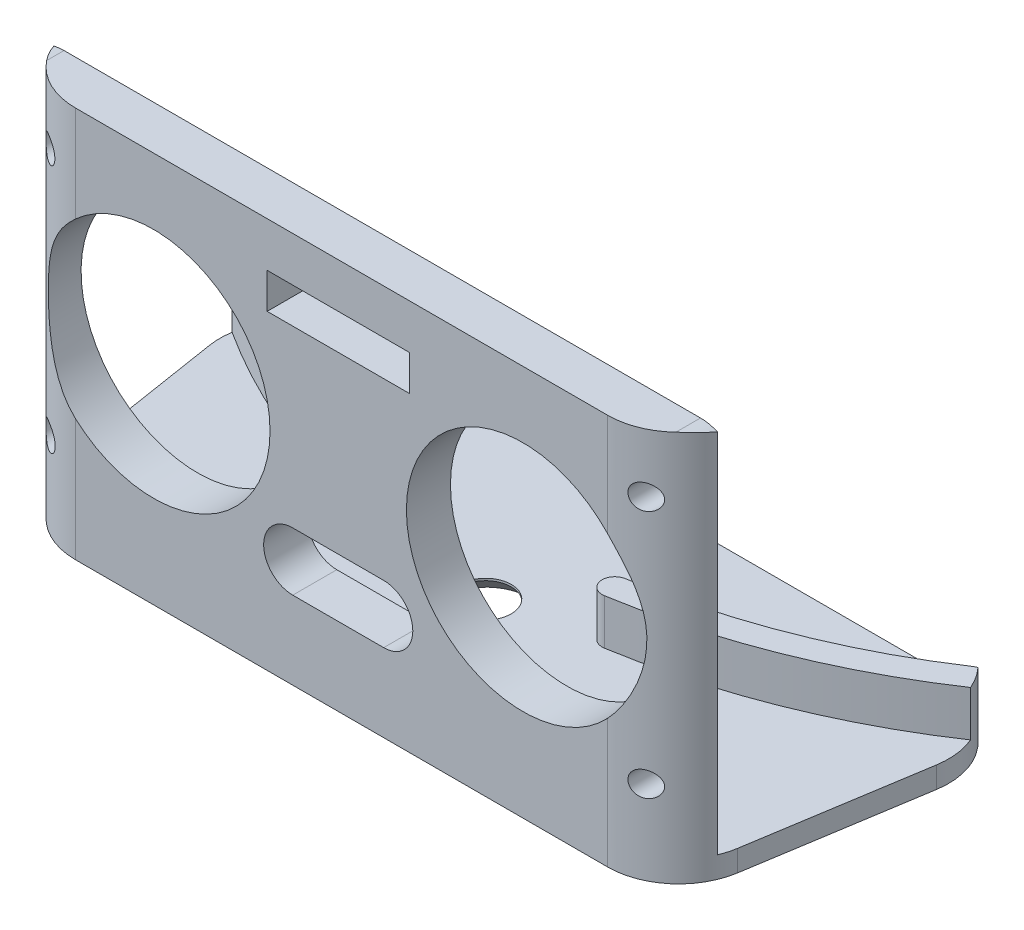
from build123d import *

# Parameters (mm, degrees)
BOSS_EXTRU_1_DEPTH                                = 1.5
BOSS_EXTRU_2_START                                = 0.3
ESQUISSE2_R                                       = 0.83
ESQUISSE2_R_2                                     = 0.87
ESQUISSE2_R_3                                     = 8.2
BOSS_EXTRU_2_DEPTH                                = 3.2
ENL_V_MAT_EXTRU_1_DEPTH                           = 937.37300154
ENL_V_MAT_EXTRU_1_DEPTH_BACK                      = 937.37300154
ESQUISSE1_2_OUTSIDE_W                             = 65.507
ESQUISSE1_2_OUTSIDE_H                             = 36.406
BOSS_EXTRU_3_START                                = 3.2
BOSS_EXTRU_3_DEPTH                                = 3.2
FRAISAGE_POUR_VIS_T_TE_FRAIS_E_BOMB_E_D           = 3.6
FRAISAGE_POUR_VIS_T_TE_FRAIS_E_BOMB_E_CSINK_D     = 6.3
FRAISAGE_POUR_VIS_T_TE_FRAIS_E_BOMB_E_CSINK_ANGLE = 90
ENL_V_MAT_EXTRU_2_DEPTH                           = 118.914346143
ENL_V_MAT_EXTRU_2_DEPTH_BACK                      = 118.914346143
ESQUISSE8_W                                       = 10.000000119
ESQUISSE8_H                                       = 2.5
ESQUISSE9_W                                       = 46.70954475
ESQUISSE9_H                                       = 0.31
ENL_V_MAT_EXTRU_3_DEPTH                           = 10
BOSS_EXTRU_4_DEPTH                                = 3.39
ENL_V_MAT_EXTRU_4_DEPTH                           = 10


with BuildPart() as part:
    # Esquisse1 → Boss.-Extru.1 (new body)
    with BuildSketch(Plane.XZ.offset(51.373319983)):
        with BuildLine():
            Line((-98.670544596, -930.328379496), (-57.379707563, -930.328379496))
            ThreePointArc((-57.379707563, -930.328379496), (-53.577586343, -928.575512729), (-52.441309896, -924.545929189))
            Line((-52.441309896, -924.545929189), (-54.35688847, -912.455846702))
            ThreePointArc((-54.35688847, -912.455846702), (-56.048152904, -909.43617579), (-59.295286137, -908.238297009))
            Line((-59.295286137, -908.238297009), (-96.754966023, -908.238297009))
            ThreePointArc((-96.754966023, -908.238297009), (-100.002099255, -909.43617579), (-101.69336369, -912.455846702))
            Line((-101.69336369, -912.455846702), (-103.608942263, -924.545929189))
            ThreePointArc((-103.608942263, -924.545929189), (-102.472665816, -928.575512729), (-98.670544596, -930.328379496))
        make_face()
    extrude(amount=BOSS_EXTRU_1_DEPTH)

    # Esquisse2 → Boss.-Extru.2 (add)
    with BuildSketch(Plane.XY.offset(-911.638297009).offset(BOSS_EXTRU_2_START)):
        with BuildLine():
            Line((-52.906931145, -51.073319983), (-52.906931145, -31.173319983))
            ThreePointArc((-52.906931145, -31.173319983), (-53.77096614, -29.087354978), (-55.856931145, -28.223319983))
            Line((-55.856931145, -28.223319983), (-100.656931145, -28.223319983))
            ThreePointArc((-100.656931145, -28.223319983), (-102.742896149, -29.087354978), (-103.606931145, -31.173319983))
            Line((-103.606931145, -31.173319983), (-103.606931145, -51.073319983))
            Line((-103.606931145, -51.073319983), (-103.608942263, -51.373319983))
            Line((-103.608942263, -51.373319983), (-52.906931145, -51.373319983))
            Line((-52.906931145, -51.373319983), (-52.906931145, -51.073319983))
        make_face()
        with Locations((-99.356931145, -32.373319983)):
            Circle(ESQUISSE2_R, mode=Mode.SUBTRACT)
        with Locations((-99.356931145, -49.873319983)):
            Circle(ESQUISSE2_R_2, mode=Mode.SUBTRACT)
        with Locations((-57.156931145, -49.873319983)):
            Circle(ESQUISSE2_R_2, mode=Mode.SUBTRACT)
        with Locations((-57.156931145, -32.373319983)):
            Circle(ESQUISSE2_R_2, mode=Mode.SUBTRACT)
        with Locations((-91.256931145, -41.073319983)):
            Circle(ESQUISSE2_R_3, mode=Mode.SUBTRACT)
        with Locations((-65.256931145, -41.073319983)):
            Circle(ESQUISSE2_R_3, mode=Mode.SUBTRACT)
    extrude(amount=BOSS_EXTRU_2_DEPTH)

    # Esquisse1<2> outside → Enlèv. mat.-Extru.1 (cut, two sides: drawn at the far end of the back side and taken through both)
    with BuildSketch(Plane.XZ.offset(51.373319983).offset(-ENL_V_MAT_EXTRU_1_DEPTH_BACK)):
        with Locations((-78.0255, -919.233)):
            Rectangle(ESQUISSE1_2_OUTSIDE_W, ESQUISSE1_2_OUTSIDE_H)
        with BuildLine():
            Line((-98.670544596, -930.328379496), (-57.379707563, -930.328379496))
            ThreePointArc((-57.379707563, -930.328379496), (-53.577586343, -928.575512729), (-52.441309896, -924.545929189))
            Line((-52.441309896, -924.545929189), (-54.35688847, -912.455846702))
            ThreePointArc((-54.35688847, -912.455846702), (-56.048152904, -909.43617579), (-59.295286137, -908.238297009))
            Line((-59.295286137, -908.238297009), (-96.754966023, -908.238297009))
            ThreePointArc((-96.754966023, -908.238297009), (-100.002099255, -909.43617579), (-101.69336369, -912.455846702))
            Line((-101.69336369, -912.455846702), (-103.608942263, -924.545929189))
            ThreePointArc((-103.608942263, -924.545929189), (-102.472665816, -928.575512729), (-98.670544596, -930.328379496))
        make_face(mode=Mode.SUBTRACT)
    extrude(amount=ENL_V_MAT_EXTRU_1_DEPTH + ENL_V_MAT_EXTRU_1_DEPTH_BACK, mode=Mode.SUBTRACT)

    # Esquisse3 → Boss.-Extru.3 (add)
    with BuildSketch(Plane(origin=(0, -51.373319983, 0), x_dir=(1, 0, 0), z_dir=(0, 1, 0)).offset(BOSS_EXTRU_3_START)):
        with BuildLine():
            ThreePointArc((-102.982508149, 927.859578881), (-103.376352569, 927.018163899), (-103.607735067, 926.118411302))
            ThreePointArc((-103.607735067, 926.118411302), (-94.922727103, 921.708622836), (-85.517242835, 919.176338626))
            ThreePointArc((-85.517242835, 919.176338626), (-84.485661398, 919.92188523), (-85.231208003, 920.953466667))
            ThreePointArc((-85.231208003, 920.953466667), (-94.473289986, 923.464655248), (-102.982508149, 927.859578881))
        make_face()
        with BuildLine():
            ThreePointArc((-71.253122945, 919.966173311), (-61.614344657, 922.608295593), (-52.765422079, 927.254092215))
            ThreePointArc((-52.765422079, 927.254092215), (-53.176239028, 928.035934163), (-53.718212164, 928.733295272))
            ThreePointArc((-53.718212164, 928.733295272), (-53.866494414, 928.670740496), (-54.005911098, 928.59034327))
            ThreePointArc((-54.005911098, 928.59034327), (-62.407028515, 924.230869883), (-71.539157777, 921.743301352))
            ThreePointArc((-71.539157777, 921.743301352), (-72.284704381, 920.711719915), (-71.253122945, 919.966173311))
        make_face()
    extrude(amount=-BOSS_EXTRU_3_DEPTH)

    # Fraisage pour vis à tête fraisée bombée M31 (through all)
    with Locations(Plane.XZ.offset(52.873319983)):
        with Locations((-78.416666646, -918.775310047)):
            CounterSinkHole(FRAISAGE_POUR_VIS_T_TE_FRAIS_E_BOMB_E_D / 2, FRAISAGE_POUR_VIS_T_TE_FRAIS_E_BOMB_E_CSINK_D / 2, counter_sink_angle=FRAISAGE_POUR_VIS_T_TE_FRAIS_E_BOMB_E_CSINK_ANGLE)

    # Esquisse8 → Enlèv. mat.-Extru.2 (cut, two sides: drawn at the far end of the back side and taken through both)
    with BuildSketch(Plane(origin=(0, 0, -911.338297009), x_dir=(-1, 0, 0), z_dir=(0, 0, -1)).offset(-ENL_V_MAT_EXTRU_2_DEPTH_BACK)):
        with Locations((78.256931086, -32.623319983)):
            Rectangle(ESQUISSE8_W, ESQUISSE8_H)
    extrude(amount=ENL_V_MAT_EXTRU_2_DEPTH + ENL_V_MAT_EXTRU_2_DEPTH_BACK, mode=Mode.SUBTRACT)

    # Esquisse9 → Enlèv. mat.-Extru.3 (cut)
    with BuildSketch(Plane.XY.offset(-908.238297009)):
        with Locations((-78.02512608, -51.218319983)):
            Rectangle(ESQUISSE9_W, ESQUISSE9_H)
    extrude(amount=-ENL_V_MAT_EXTRU_3_DEPTH, mode=Mode.SUBTRACT)


with BuildPart() as enl_v_mat_extru_3_piece_1:
    # of the separate pieces the step leaves, piece 1, a body of its own (enl_v_mat_extru_3_pieces)
    add(part.part.solids().sort_by_distance((-101.69336369, -51.373319983, -912.455846702))[0])



with BuildPart() as enl_v_mat_extru_3_piece_2:
    # of the separate pieces the step leaves, piece 2, a body of its own (enl_v_mat_extru_3_pieces)
    add(part.part.solids().sort_by_distance((-96.754966023, -51.063319983, -908.238297009))[0])


with BuildPart() as enl_v_mat_extru_3_piece_2_1:
    # Corps-Déplacer/Copier1: moved
    add(enl_v_mat_extru_3_piece_2.part.moved(Location((0, 2.89, 0))))


with BuildPart() as enl_v_mat_extru_3_piece_1_1:
    add(enl_v_mat_extru_3_piece_1.part)

    add(enl_v_mat_extru_3_piece_2_1.part)  # Boss.-Extru.4 merges Enlèv. mat.-Extru.3 piece 2
    # Esquisse10 → Boss.-Extru.4 (add)
    with BuildSketch(Plane.XZ.offset(48.173319983)):
        with BuildLine():
            Line((-59.295286137, -908.238297009), (-96.754966023, -908.238297009))
            ThreePointArc((-96.754966023, -908.238297009), (-99.538848204, -909.084985078), (-101.379898455, -911.338297009))
            Line((-101.379898455, -911.338297009), (-54.670353705, -911.338297009))
            ThreePointArc((-54.670353705, -911.338297009), (-56.511403955, -909.084985078), (-59.295286137, -908.238297009))
        make_face()
    extrude(amount=BOSS_EXTRU_4_DEPTH)

    # Esquisse11 → Enlèv. mat.-Extru.4 (cut)
    with BuildSketch(Plane.XY.offset(-908.238297009)):
        with BuildLine():
            Line((-81.456931145, -43.283319983), (-75.056931145, -43.283319983))
            ThreePointArc((-75.056931145, -43.283319983), (-73.006931145, -45.333319983), (-75.056931145, -47.383319983))
            Line((-75.056931145, -47.383319983), (-81.456931145, -47.383319983))
            ThreePointArc((-81.456931145, -47.383319983), (-83.506931145, -45.333319983), (-81.456931145, -43.283319983))
        make_face()
    extrude(amount=-ENL_V_MAT_EXTRU_4_DEPTH, mode=Mode.SUBTRACT)


solid = enl_v_mat_extru_3_piece_1_1.part
